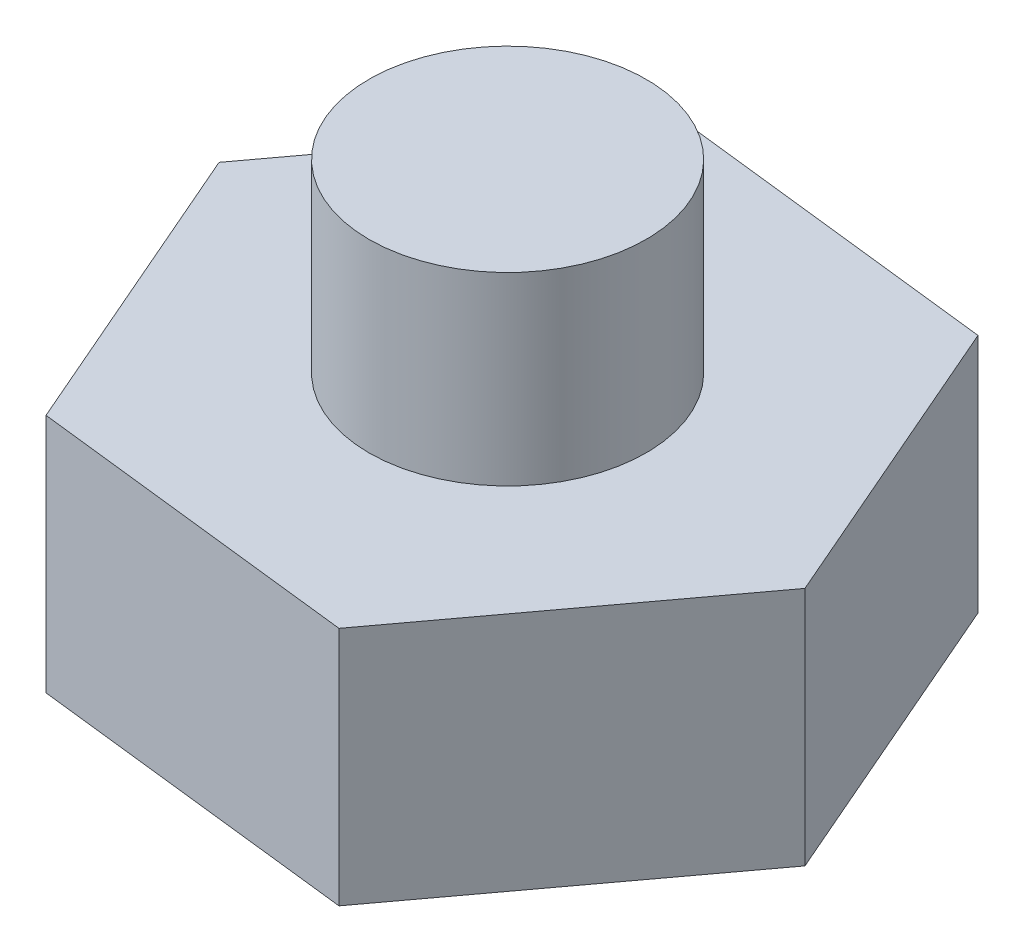
from build123d import *

# Parameters (mm, degrees)
SKETCH2_R           = 37.5
BOSS_EXTRUDE1_DEPTH = 65
SKETCH2_2_R         = 37.5
BOSS_EXTRUDE2_DEPTH = 115


with BuildPart() as part:
    # Sketch2 → Boss-Extrude1 (new body)
    with BuildSketch(Plane(origin=(0, 0, 0), x_dir=(1, 0, 0), z_dir=(0, 1, 0))):
        Polygon((35.850024354, -82.647676974), (89.5, -10.27680667), (53.649975646, 72.370870304), (-35.850024354, 82.647676974), (-89.5, 10.27680667), (-53.649975646, -72.370870304), align=None)
        with Locations((-1.191522738, 0)):
            Circle(SKETCH2_R, mode=Mode.SUBTRACT)
    extrude(amount=BOSS_EXTRUDE1_DEPTH)

    # Sketch2<2> → Boss-Extrude2 (add)
    with BuildSketch(Plane(origin=(0, 0, 0), x_dir=(1, 0, 0), z_dir=(0, 1, 0))):
        with Locations((-1.191522738, 0)):
            Circle(SKETCH2_2_R)
    extrude(amount=BOSS_EXTRUDE2_DEPTH)


solid = part.part
